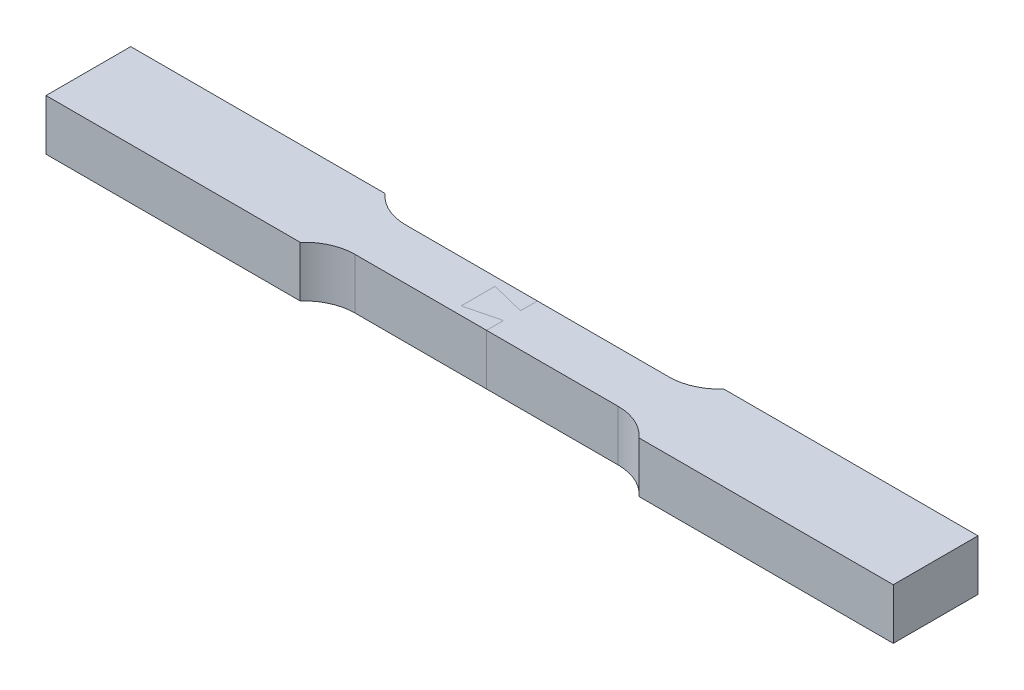
from build123d import *

# Parameters (mm, degrees)
BOSS_EXTRUDE1_DEPTH = 6
BOSS_EXTRUDE2_DEPTH = 6


with BuildPart() as part:
    # Sketch1 → Boss-Extrude1 (new body)
    with BuildSketch(Plane(origin=(0, 0, 0), x_dir=(1, 0, 0), z_dir=(0, 1, 0))):
        with BuildLine():
            Line((0, 1), (0, 3))
            Line((0, 3), (-15.527864045, 3))
            ThreePointArc((-15.527864045, 3), (-17.977353788, 3.522774425), (-20, 5))
            Line((-20, 5), (-50, 5))
            Line((-50, 5), (-50, -5))
            Line((-50, -5), (-20, -5))
            ThreePointArc((-20, -5), (-17.977353788, -3.522774425), (-15.527864045, -3))
            Line((-15.527864045, -3), (0, -3))
            Line((0, -3), (0, -1))
            Line((0, -1), (-4, -2))
            Line((-4, -2), (-4, 2))
            Line((-4, 2), (0, 1))
        make_face()
    extrude(amount=BOSS_EXTRUDE1_DEPTH)


with BuildPart() as body_2:
    # Sketch1<4> → Boss-Extrude2 (new body)
    with BuildSketch(Plane(origin=(0, 0, 0), x_dir=(1, 0, 0), z_dir=(0, 1, 0))):
        with BuildLine():
            ThreePointArc((20, 5), (17.977353788, 3.522774425), (15.527864045, 3))
            Line((15.527864045, 3), (0, 3))
            Line((0, 3), (0, 1))
            Line((0, 1), (-4, 2))
            Line((-4, 2), (-4, -2))
            Line((-4, -2), (0, -1))
            Line((0, -1), (0, -3))
            Line((0, -3), (15.527864045, -3))
            ThreePointArc((15.527864045, -3), (17.977353788, -3.522774425), (20, -5))
            Line((20, -5), (50, -5))
            Line((50, -5), (50, 5))
            Line((50, 5), (20, 5))
        make_face()
    extrude(amount=BOSS_EXTRUDE2_DEPTH)


solid = Compound([part.part, body_2.part])
